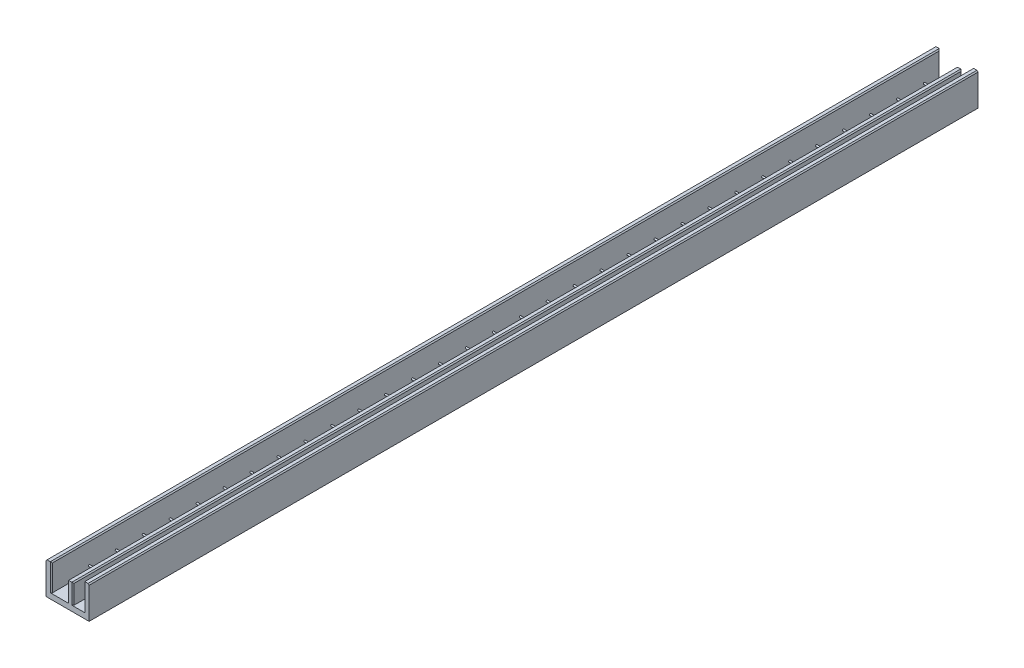
from build123d import *

# Parameters (mm, degrees)
SALIENTE_EXTRUIR1_DEPTH = 16500
CHAFL_N2_SIZE           = 20
SALIENTE_EXTRUIR2_REACH = 16532.275
CROQUIS2_R              = 15
MATRIZL1_COUNT          = 32
MATRIZL1_PITCH          = 500


with BuildPart() as part:
    # Croquis1 → Saliente-Extruir1 (new body)
    with BuildSketch(Plane.XY):
        Polygon((0, 0), (-800, 0), (-800, 600), (-700, 600), (-700, 100), (-400, 100), (-400, 470), (-300, 470), (-300, 100), (-100, 100), (-100, 600), (0, 600), align=None)
    extrude(amount=SALIENTE_EXTRUIR1_DEPTH)

    # Chaflán2
    chafl_n2_edges = [part.edges().sort_by_distance(p)[0] for p in [
        (-100, 350, 16500),
        (-700, 350, 0),
        (-400, 285, 0),
        (-300, 285, 0),
        (-100, 350, 0),
        (-300, 285, 16500),
        (-800, 600, 8250),
        (-700, 600, 8250),
        (-400, 470, 8250),
        (-300, 470, 8250),
        (-100, 600, 8250),
        (0, 600, 8250),
        (-400, 285, 16500),
        (-700, 350, 16500),
    ]]
    chamfer(chafl_n2_edges, length=CHAFL_N2_SIZE)

    # Saliente-Extruir2: up to this face of the body (flat: up to its plane)
    saliente_extruir2_end = Plane(part.part.faces().sort_by_distance((-100, 340, 8250))[0])
    # Croquis2 → Saliente-Extruir2 (add, up to the picked face)
    with BuildSketch(Plane.ZY.offset(800), mode=Mode.PRIVATE) as saliente_extruir2_sk1:
        with Locations(Location((300, 200, 0), (0, 0, 270))):
            Circle(CROQUIS2_R)
    saliente_extruir2_tool1 = split(extrude(saliente_extruir2_sk1.sketch, amount=-SALIENTE_EXTRUIR2_REACH, mode=Mode.PRIVATE), bisect_by=saliente_extruir2_end, keep=Keep.BOTH, mode=Mode.PRIVATE)
    saliente_extruir2 = saliente_extruir2_tool1.solids().sort_by(Axis((-800, 200, 300), (1, 0, 0)))[0]
    add(saliente_extruir2)

    # MatrizL1: Saliente-Extruir2 ×32
    with Locations(*[(0, 0, i * MATRIZL1_PITCH) for i in range(1, MATRIZL1_COUNT)]):
        add(saliente_extruir2)


solid = part.part
